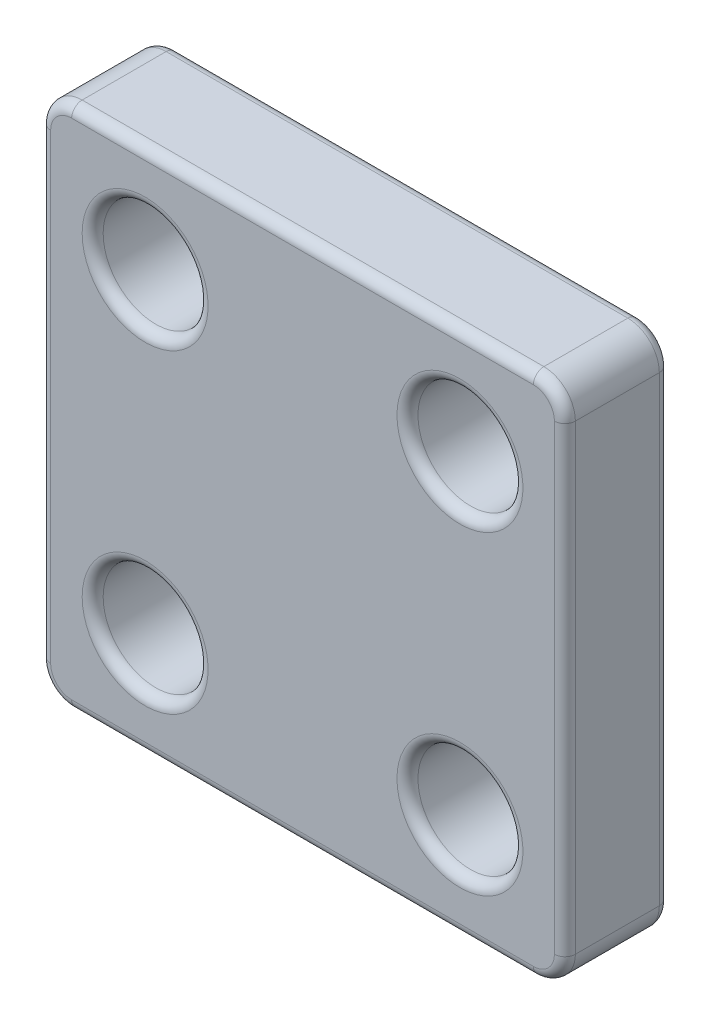
from build123d import *

# Parameters (mm, degrees)
SKETCH1_W           = 50
SKETCH1_H           = 50
BOSS_EXTRUDE1_DEPTH = 10
SKETCH2_R           = 5
CUT_EXTRUDE1_DEPTH  = 10
FILLET1_R           = 3
FILLET2_R           = 1


with BuildPart() as part:
    # Sketch1 → Boss-Extrude1 (new body)
    with BuildSketch(Plane.XY):
        Rectangle(SKETCH1_W, SKETCH1_H)
    extrude(amount=BOSS_EXTRUDE1_DEPTH)

    # Sketch2 → Cut-Extrude1 (cut)
    with BuildSketch(Plane.XY.offset(10)):
        with Locations((-15, 15)):
            Circle(SKETCH2_R)
        with Locations((15, 15)):
            Circle(SKETCH2_R)
        with Locations((15, -15)):
            Circle(SKETCH2_R)
        with Locations((-15, -15)):
            Circle(SKETCH2_R)
    extrude(amount=-CUT_EXTRUDE1_DEPTH, mode=Mode.SUBTRACT)

    # Fillet1
    fillet1_edges = [part.edges().sort_by_distance(p)[0] for p in [
        (-25, 25, 5),
        (25, 25, 5),
        (25, -25, 5),
        (-25, -25, 5),
    ]]
    fillet(fillet1_edges, radius=FILLET1_R)

    # Fillet2
    fillet2_edges = [part.edges().sort_by_distance(p)[0] for p in [
        (-20, 15, 0),
        (-20, 15, 10),
        (-20, -15, 0),
        (-20, -15, 10),
        (10, -15, 0),
        (10, -15, 10),
        (10, 15, 0),
        (10, 15, 10),
        (-25, 0, 0),
        (-25, 0, 10),
        (0, 25, 0),
        (25, 0, 0),
        (0, -25, 0),
        (24.121320344, 24.121320344, 0),
        (24.121320344, -24.121320344, 0),
        (-24.121320344, -24.121320344, 0),
        (-24.121320344, 24.121320344, 0),
        (0, 25, 10),
        (0, -25, 10),
        (25, 0, 10),
        (24.121320344, 24.121320344, 10),
        (24.121320344, -24.121320344, 10),
        (-24.121320344, -24.121320344, 10),
        (-24.121320344, 24.121320344, 10),
    ]]
    fillet(fillet2_edges, radius=FILLET2_R)


solid = part.part
